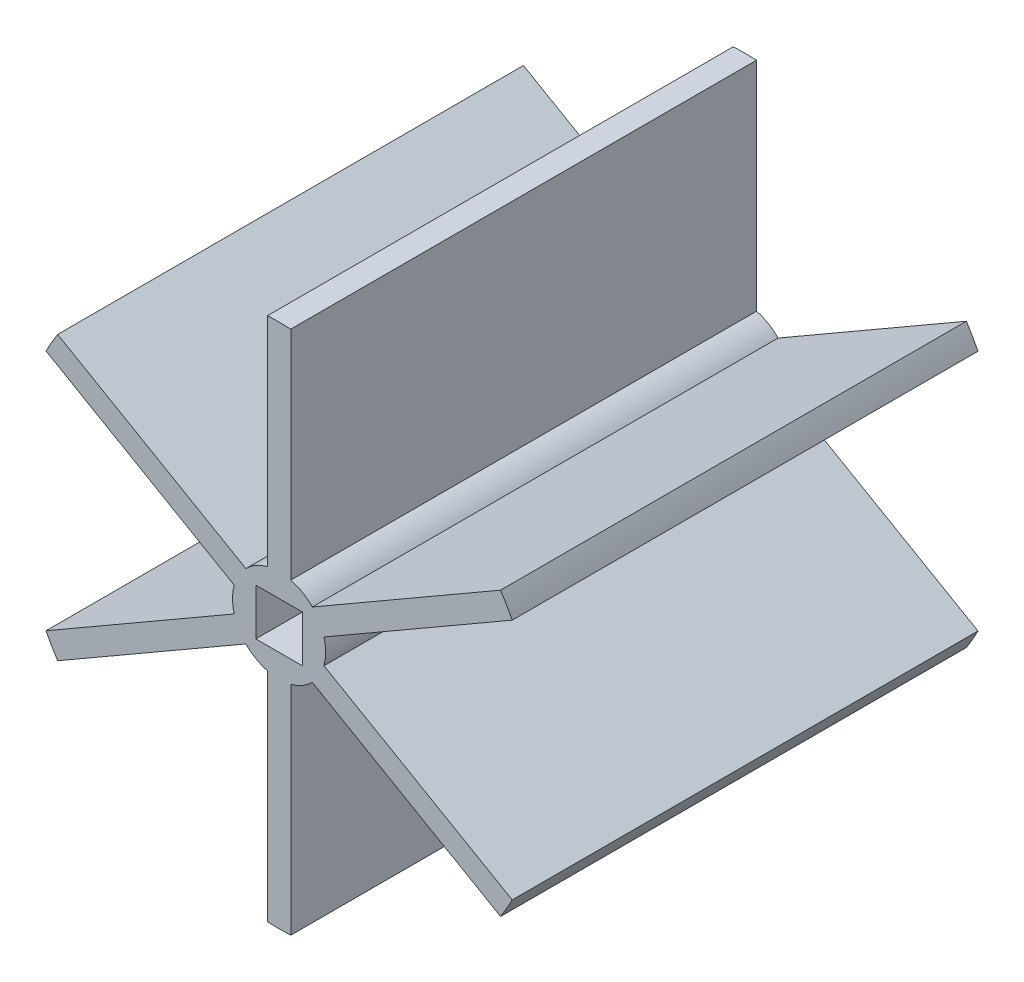
from build123d import *

# Parameters (mm, degrees)
ESQUISSE1_W        = 5
ESQUISSE1_H        = 5
BOSS_EXTRU_1_DEPTH = 25


with BuildPart() as part:
    # Esquisse1 → Boss.-Extru.1 (new, symmetric)
    with BuildSketch(Plane.XY):
        with BuildLine():
            Line((25.022912308, -13.003609484), (4.817627458, -1.338082837))
            ThreePointArc((4.817627458, -1.338082837), (5, 0), (4.817627458, 1.338082837))
            Line((4.817627458, 1.338082837), (25.022912308, 13.003609484))
            ThreePointArc((25.022912308, 13.003609484), (24.421916387, 14.1), (23.772912308, 15.168672994))
            Line((23.772912308, 15.168672994), (3.567627458, 3.503146346))
            ThreePointArc((3.567627458, 3.503146346), (2.5, 4.330127019), (1.25, 4.841229183))
            Line((1.25, 4.841229183), (1.25, 28.172282478))
            ThreePointArc((1.25, 28.172282478), (0, 28.2), (-1.25, 28.172282478))
            Line((-1.25, 28.172282478), (-1.25, 4.841229183))
            ThreePointArc((-1.25, 4.841229183), (-2.5, 4.330127019), (-3.567627458, 3.503146346))
            Line((-3.567627458, 3.503146346), (-23.772912308, 15.168672994))
            ThreePointArc((-23.772912308, 15.168672994), (-24.421916387, 14.1), (-25.022912308, 13.003609484))
            Line((-25.022912308, 13.003609484), (-4.817627458, 1.338082837))
            ThreePointArc((-4.817627458, 1.338082837), (-5, 0), (-4.817627458, -1.338082837))
            Line((-4.817627458, -1.338082837), (-25.022912308, -13.003609484))
            ThreePointArc((-25.022912308, -13.003609484), (-24.421916387, -14.1), (-23.772912308, -15.168672994))
            Line((-23.772912308, -15.168672994), (-3.567627458, -3.503146346))
            ThreePointArc((-3.567627458, -3.503146346), (-2.5, -4.330127019), (-1.25, -4.841229183))
            Line((-1.25, -4.841229183), (-1.25, -28.172282478))
            ThreePointArc((-1.25, -28.172282478), (0, -28.2), (1.25, -28.172282478))
            Line((1.25, -28.172282478), (1.25, -4.841229183))
            ThreePointArc((1.25, -4.841229183), (2.5, -4.330127019), (3.567627458, -3.503146346))
            Line((3.567627458, -3.503146346), (23.772912308, -15.168672994))
            ThreePointArc((23.772912308, -15.168672994), (24.421916387, -14.1), (25.022912308, -13.003609484))
        make_face()
        Rectangle(ESQUISSE1_W, ESQUISSE1_H, mode=Mode.SUBTRACT)
    extrude(amount=BOSS_EXTRU_1_DEPTH, both=True)


solid = part.part
